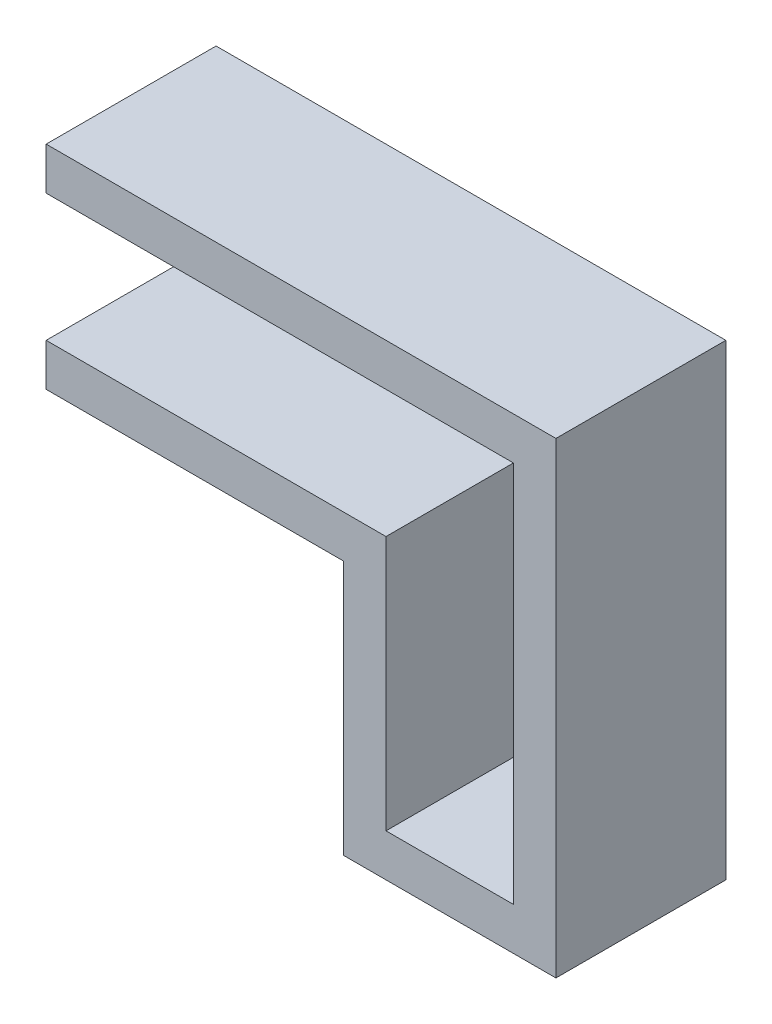
from build123d import *

# Parameters (mm, degrees)
EXTRUDE_1_DEPTH     = 40
CUT_EXTRUDE_1_DEPTH = 30


with BuildPart() as part:
    # 스케치1 → 보스-돌출1 (new body)
    with BuildSketch(Plane.XY):
        Polygon((70, -50), (70, -110), (120, -110), (120, 0), (0, 0), (0, -50), align=None)
    extrude(amount=EXTRUDE_1_DEPTH)

    # 스케치2 → 컷-돌출1 (cut)
    with BuildSketch(Plane.XY.offset(40)):
        Polygon((80, -40), (80, -100), (110, -100), (110, -10), (0, -10), (0, -40), align=None)
    extrude(amount=-CUT_EXTRUDE_1_DEPTH, mode=Mode.SUBTRACT)


solid = part.part
